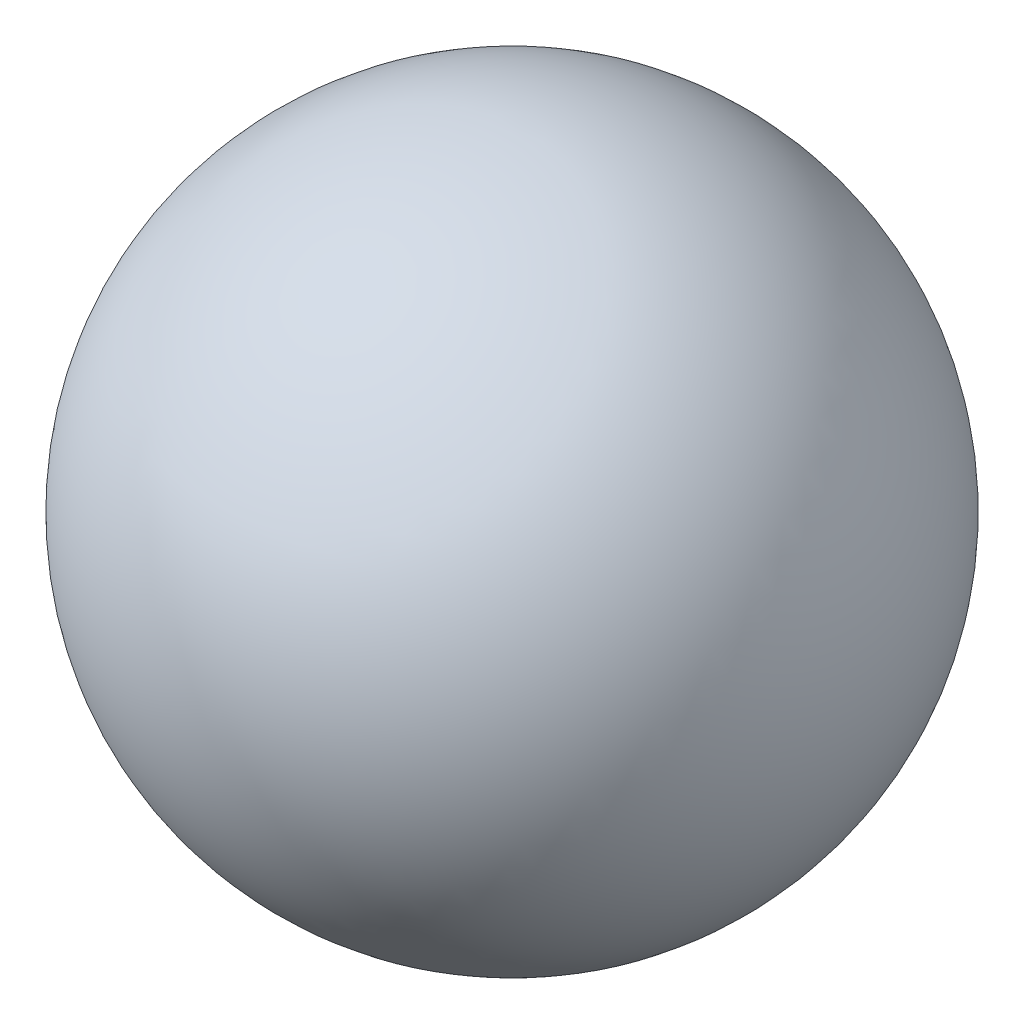
from build123d import *


with BuildPart() as part:
    # Sketch2 → Revolve1 (revolve)
    with BuildSketch(Plane(origin=(0, 0, 0), x_dir=(0, 0, -1), z_dir=(1, 0, 0))):
        with BuildLine():
            ThreePointArc((0, 2.25), (2.25, 0), (0, -2.25))
            Line((0, -2.25), (0, 2.25))
        make_face()
    revolve(axis=Axis((0, -2.25, 0), (0, 1, 0)))


solid = part.part
